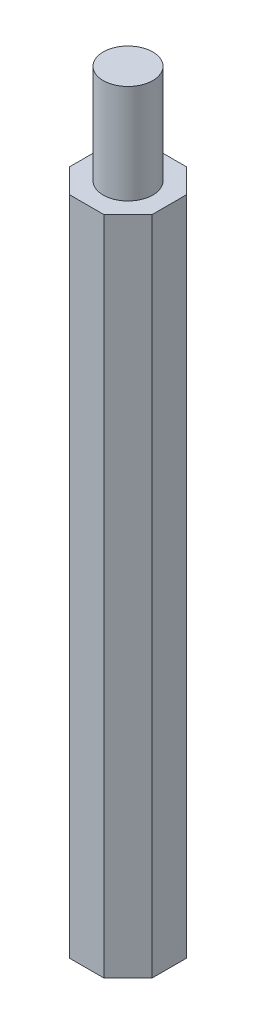
from build123d import *

# Parameters (mm, degrees)
EXTRUSION1_DEPTH        = 20
ESQUISSE2_R             = 1.5
EXTRUSION2_DEPTH        = 6
ESQUISSE3_R             = 1.5
ENL_V_MAT_EXTRU_1_DEPTH = 7


with BuildPart() as part:
    # Esquisse1 → Extrusion1 (new, symmetric)
    with BuildSketch(Plane(origin=(0, 0, 0), x_dir=(1, 0, 0), z_dir=(0, 1, 0))):
        Polygon((-1.035533906, 2.5), (1.035533906, 2.5), (2.5, 1.035533906), (2.5, -1.035533906), (1.035533906, -2.5), (-1.035533906, -2.5), (-2.5, -1.035533906), (-2.5, 1.035533906), align=None)
    extrude(amount=EXTRUSION1_DEPTH, both=True)

    # Esquisse2 → Extrusion2 (add)
    with BuildSketch(Plane(origin=(0, 20, 0), x_dir=(1, 0, 0), z_dir=(0, 1, 0))):
        with Locations(Location((0, 0, 0), (0, 0, 270))):
            Circle(ESQUISSE2_R)
    extrude(amount=EXTRUSION2_DEPTH)

    # Esquisse3 → Enlèv. mat.-Extru.1 (cut)
    with BuildSketch(Plane.XZ.offset(20)):
        with Locations(Location((0, 0, 0), (0, 0, 90))):
            Circle(ESQUISSE3_R)
    extrude(amount=-ENL_V_MAT_EXTRU_1_DEPTH, mode=Mode.SUBTRACT)


solid = part.part
